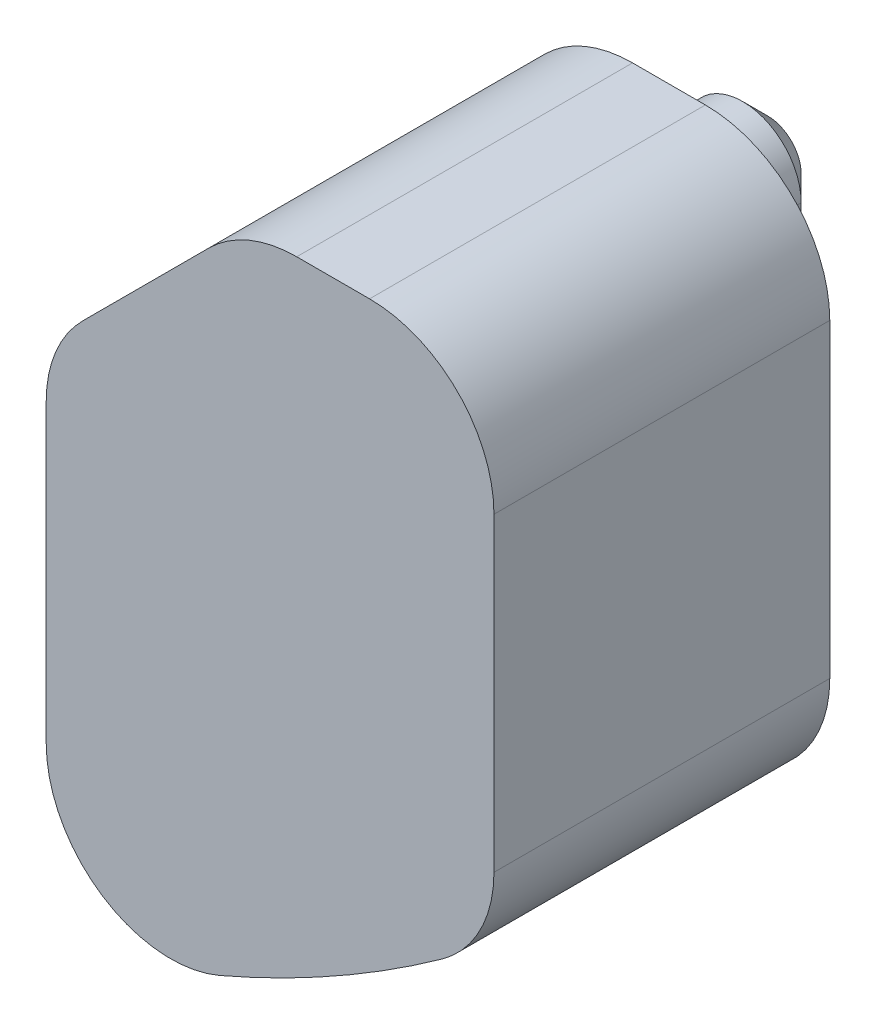
from build123d import *

# Parameters (mm, degrees)
BODY_DEPTH                                = 6.75
FILLET1_R                                 = 2.5
F_9_64_0_14063_DIAMETER_HOLE1_D           = 3.572002
F_9_64_0_14063_DIAMETER_HOLE1_DEPTH       = 7
F_9_64_0_14063_DIAMETER_HOLE1_CSINK_D     = 4.842002
F_9_64_0_14063_DIAMETER_HOLE1_CSINK_ANGLE = 45
F_9_64_0_14063_DIAMETER_HOLE1_TIP         = 1.073137666
MOUNT_PEG_DEPTH                           = 3
PEG_CHAMFER_SIZE                          = 0.5


with BuildPart() as part:
    # Sketch1 → body (new body)
    with BuildSketch(Plane.XY):
        with BuildLine():
            Line((6, -23.237900077), (6, -12.760161762))
            Line((6, -12.760161762), (10, -8.760161762))
            Line((10, -8.760161762), (15, -8.760161762))
            Line((15, -8.760161762), (15, -18.734993995))
            ThreePointArc((15, -18.734993995), (10.738670346, -21.463479662), (6, -23.237900077))
        make_face()
    extrude(amount=BODY_DEPTH)

    # Fillet1
    fillet1_edges = [part.edges().sort_by_distance(p)[0] for p in [
        (6, -23.237900077, 3.375),
        (6, -12.760161762, 3.375),
        (10, -8.760161762, 3.375),
        (15, -8.760161762, 3.375),
        (15, -18.734993995, 3.375),
    ]]
    fillet(fillet1_edges, radius=FILLET1_R)

    # 9/64 (0.14063) Diameter Hole1
    with Locations(Plane.ZY.offset(-6)):
        with Locations((4, -17.060161762)):
            CounterSinkHole(F_9_64_0_14063_DIAMETER_HOLE1_D / 2, F_9_64_0_14063_DIAMETER_HOLE1_CSINK_D / 2, depth=F_9_64_0_14063_DIAMETER_HOLE1_DEPTH, counter_sink_angle=F_9_64_0_14063_DIAMETER_HOLE1_CSINK_ANGLE)
            with Locations((0, 0, -(F_9_64_0_14063_DIAMETER_HOLE1_DEPTH + F_9_64_0_14063_DIAMETER_HOLE1_TIP / 2))):  # 118° drill point
                Cone(0, F_9_64_0_14063_DIAMETER_HOLE1_D / 2, F_9_64_0_14063_DIAMETER_HOLE1_TIP, mode=Mode.SUBTRACT)

    # Sketch4 → mount peg (add)
    with BuildSketch(Plane(origin=(0, 0, 0), x_dir=(-1, 0, 0), z_dir=(0, 0, -1))):
        with BuildLine():
            Line((-9.575, -19), (-9.575, -12))
            ThreePointArc((-9.575, -12), (-10.75, -10.825), (-11.925, -12))
            Line((-11.925, -12), (-11.925, -19))
            ThreePointArc((-11.925, -19), (-10.75, -20.175), (-9.575, -19))
        make_face()
    extrude(amount=MOUNT_PEG_DEPTH)

    # peg chamfer
    peg_chamfer_edges = [part.edges().sort_by_distance(p)[0] for p in [
        (11.925, -15.5, -3),
        (10.75, -10.825, -3),
        (9.575, -15.5, -3),
        (10.75, -20.175, -3),
    ]]
    chamfer(peg_chamfer_edges, length=PEG_CHAMFER_SIZE)


solid = part.part
